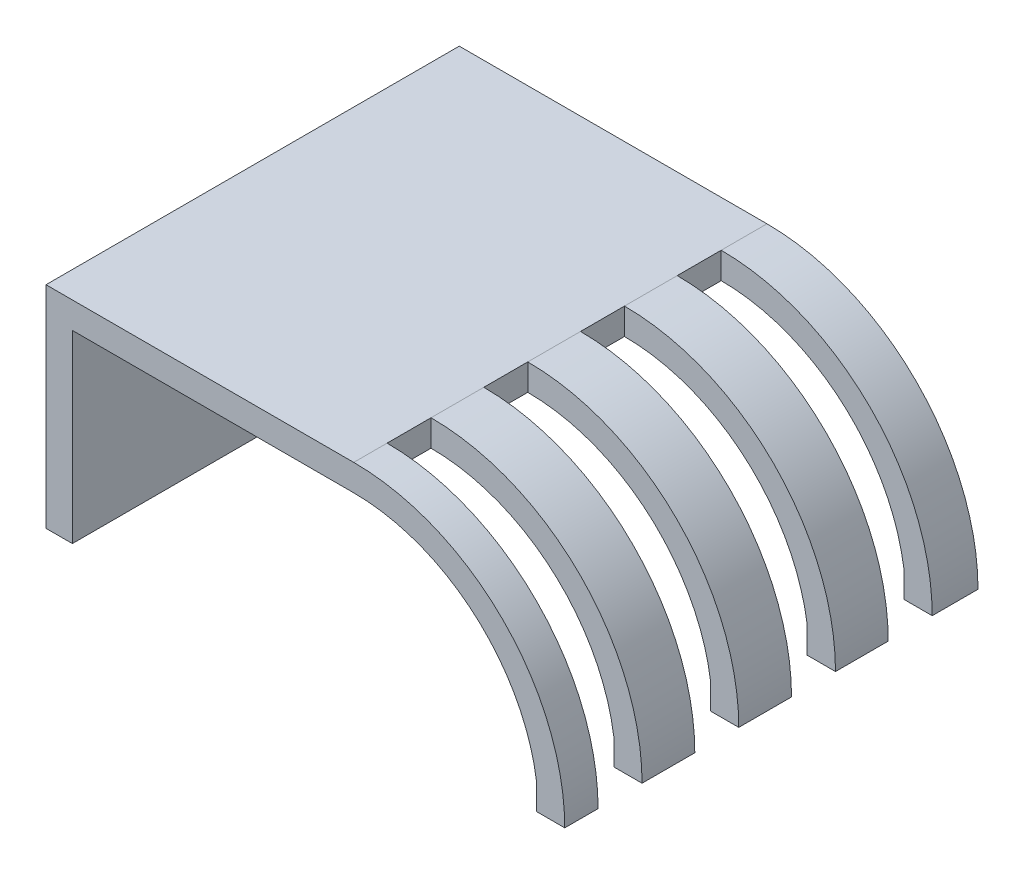
from build123d import *

# Parameters (mm, degrees)
SKETCH1_W           = 35
SKETCH1_H           = 23.5
BOSS_EXTRUDE1_DEPTH = 12
CUT_EXTRUDE1_DEPTH  = 32.662280398
CUT_EXTRUDE2_DEPTH  = 32.662280398
SKETCH5_W           = 26.392304845
SKETCH5_H           = 23.5
CUT_EXTRUDE3_DEPTH  = 12
SKETCH6_W           = 14.786732963
SKETCH6_H           = 2.5
CUT_EXTRUDE4_DEPTH  = 25.255154091


with BuildPart() as part:
    # Sketch1 → Boss-Extrude1 (new body)
    with BuildSketch(Plane(origin=(0, 0, 0), x_dir=(1, 0, 0), z_dir=(0, 1, 0))):
        Rectangle(SKETCH1_W, SKETCH1_H)
    extrude(amount=BOSS_EXTRUDE1_DEPTH)

    # Sketch3 → Cut-Extrude1 (cut, through all)
    with BuildSketch(Plane.XY.offset(11.75)):
        with BuildLine():
            Line((17.5, 12), (0, 12))
            ThreePointArc((0, 12), (8.485281374, 8.485281374), (12, 0))
            Line((12, 0), (17.5, 0))
            Line((17.5, 0), (17.5, 12))
        make_face()
    extrude(amount=-CUT_EXTRUDE1_DEPTH, mode=Mode.SUBTRACT)

    # Sketch4 → Cut-Extrude2 (cut, through all)
    with BuildSketch(Plane.XY.offset(11.75)):
        with BuildLine():
            Line((-16, 1.5), (10.392304845, 1.5))
            ThreePointArc((10.392304845, 1.5), (6.873863542, 7.937253933), (0, 10.5))
            Line((0, 10.5), (-16, 10.5))
            Line((-16, 10.5), (-16, 1.5))
        make_face()
    extrude(amount=-CUT_EXTRUDE2_DEPTH, mode=Mode.SUBTRACT)

    # Sketch5 → Cut-Extrude3 (cut)
    with BuildSketch(Plane(origin=(0, 1.5, 0), x_dir=(1, 0, 0), z_dir=(0, 1, 0))):
        with Locations((-2.803847578, 0)):
            Rectangle(SKETCH5_W, SKETCH5_H)
    extrude(amount=-CUT_EXTRUDE3_DEPTH, mode=Mode.SUBTRACT)

    # Sketch6 → Cut-Extrude4 (cut, through all)
    with BuildSketch(Plane(origin=(0, 12, 0), x_dir=(1, 0, 0), z_dir=(0, 1, 0))):
        with Locations((7.393366482, -8.60416966)):
            Rectangle(SKETCH6_W, SKETCH6_H)
        with Locations((7.393366482, -3.10416966)):
            Rectangle(SKETCH6_W, SKETCH6_H)
        with Locations((7.393366482, 2.39583034)):
            Rectangle(SKETCH6_W, SKETCH6_H)
        with Locations((7.393366482, 7.89583034)):
            Rectangle(SKETCH6_W, SKETCH6_H)
    extrude(amount=-CUT_EXTRUDE4_DEPTH, mode=Mode.SUBTRACT)


solid = part.part
